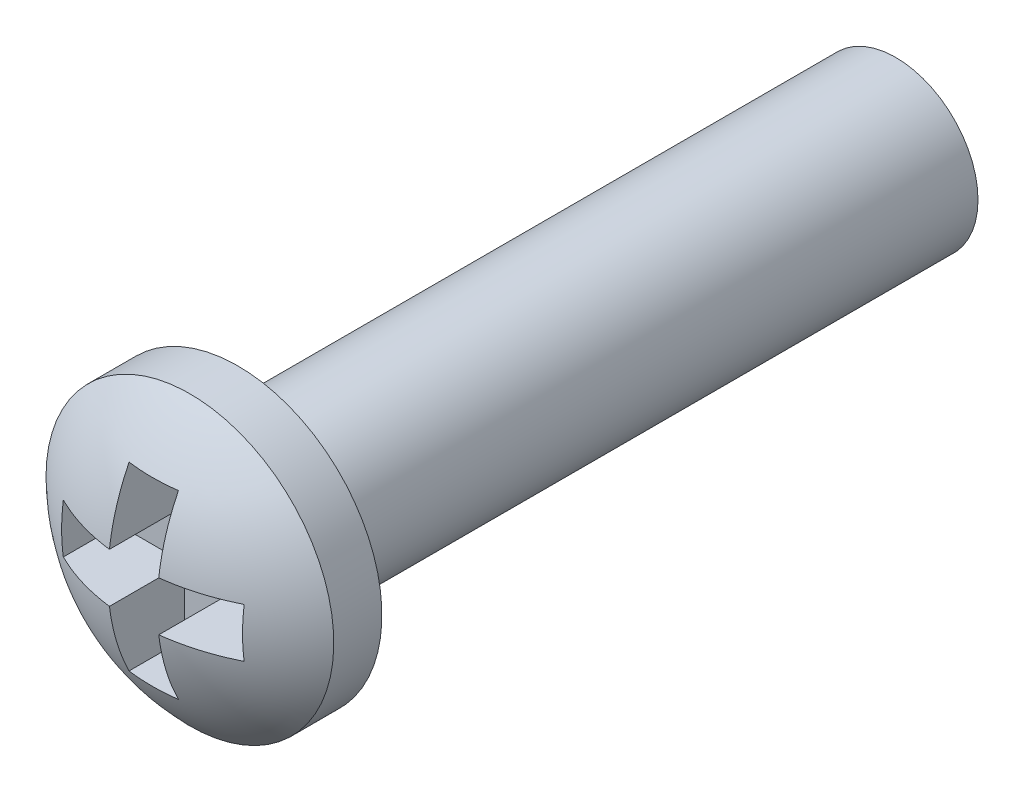
from build123d import *

# Parameters (mm, degrees)
SKETCH_1_R        = 1
EXTRUDE_198_DEPTH = 8
PH1_START         = 1.31
PH1_DEPTH         = 0.96


with BuildPart() as part:
    # 草图1 → Extrude 198 (new body)
    with BuildSketch(Plane.XY):
        Circle(SKETCH_1_R)
    extrude(amount=-EXTRUDE_198_DEPTH)

    # 草图6 → Revolve 324 (revolve)
    with BuildSketch(Plane(origin=(0, 0, 0), x_dir=(1, 0, 0), z_dir=(0, 1, 0)), mode=Mode.PRIVATE) as revolve_324_sk:
        with BuildLine():
            Line((0, 0), (1.75, 0))
            Line((1.75, 0), (1.75, -0.585357107))
            ThreePointArc((1.75, -0.585357107), (0.945147404, -1.114453798), (0, -1.3))
            Line((0, -1.3), (0, 0))
        make_face()
    revolve(revolve_324_sk.sketch.rotate(Axis((0, 0, -2), (0, 0, 1)), 180), axis=Axis((0, 0, -2), (0, 0, 1)))

    # 草图7 → 十字槽_PH1_简化 (cut)
    with BuildSketch(Plane.XY.offset(PH1_START)):
        Polygon((-0.3, -1.1), (0.3, -1.1), (0.3, -0.3), (1.1, -0.3), (1.1, 0.3), (0.3, 0.3), (0.3, 1.1), (-0.3, 1.1), (-0.3, 0.3), (-1.1, 0.3), (-1.1, -0.3), (-0.3, -0.3), align=None)
    extrude(amount=-PH1_DEPTH, mode=Mode.SUBTRACT)


solid = part.part
